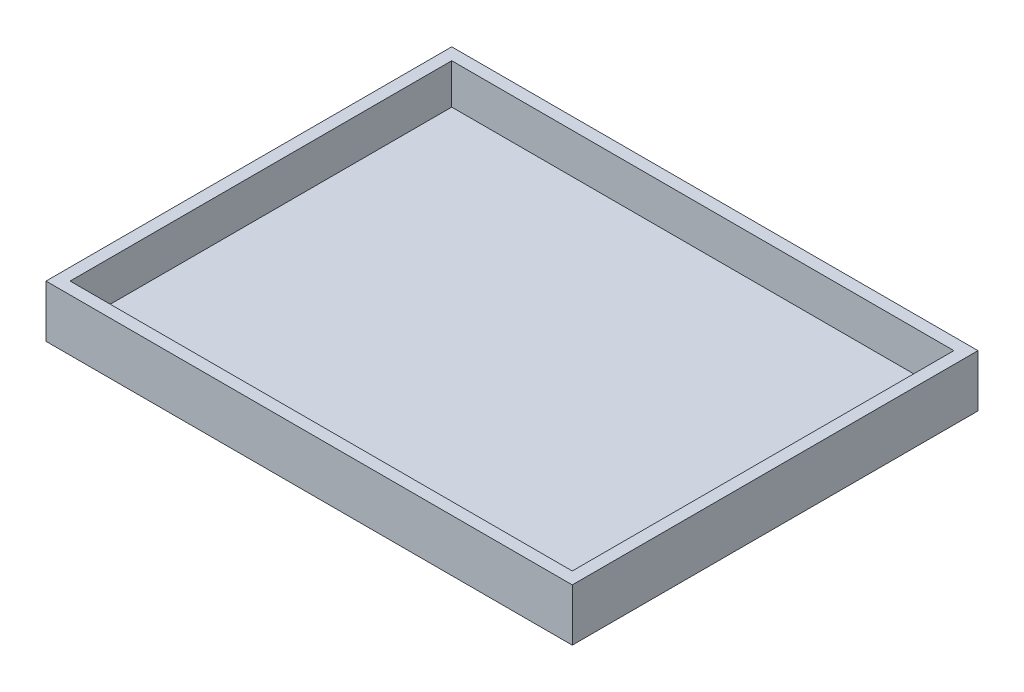
from build123d import *

# Parameters (mm, degrees)
SKETCH1_W           = 50
SKETCH1_H           = 38
BOSS_EXTRUDE1_DEPTH = 4
SHELL1_T            = 1.2


with BuildPart() as part:
    # Sketch1 → Boss-Extrude1 (new body)
    with BuildSketch(Plane(origin=(0, 0, 0), x_dir=(1, 0, 0), z_dir=(0, 1, 0))):
        with Locations((25, -19)):
            Rectangle(SKETCH1_W, SKETCH1_H)
    extrude(amount=BOSS_EXTRUDE1_DEPTH)

    # Shell1
    shell1_openings = [part.faces().sort_by_distance(p)[0] for p in [
        (25, 4, 19),
    ]]
    offset(amount=SHELL1_T, openings=shell1_openings, kind=Kind.INTERSECTION)


solid = part.part
